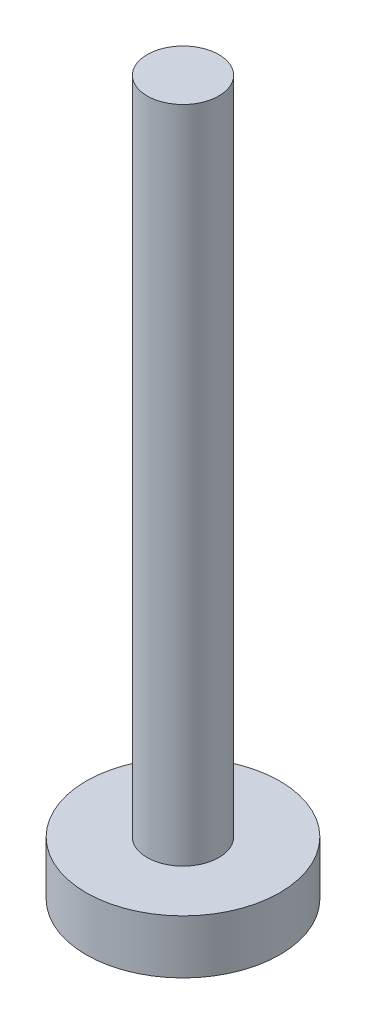
from build123d import *

# Parameters (mm, degrees)
SKETCH1_R           = 6.858
BOSS_EXTRUDE1_DEPTH = 3.81
SKETCH2_R           = 2.54
BOSS_EXTRUDE2_DEPTH = 46.736


with BuildPart() as part:
    # Sketch1 → Boss-Extrude1 (new body)
    with BuildSketch(Plane(origin=(0, 0, 0), x_dir=(1, 0, 0), z_dir=(0, 1, 0))):
        with Locations(Location((0, 0, 0), (0, 0, 90))):
            Circle(SKETCH1_R)
    extrude(amount=BOSS_EXTRUDE1_DEPTH)

    # Sketch2 → Boss-Extrude2 (add)
    with BuildSketch(Plane(origin=(0, 3.81, 0), x_dir=(1, 0, 0), z_dir=(0, 1, 0))):
        with Locations(Location((0, 0, 0), (0, 0, 270))):
            Circle(SKETCH2_R)
    extrude(amount=BOSS_EXTRUDE2_DEPTH)


solid = part.part
